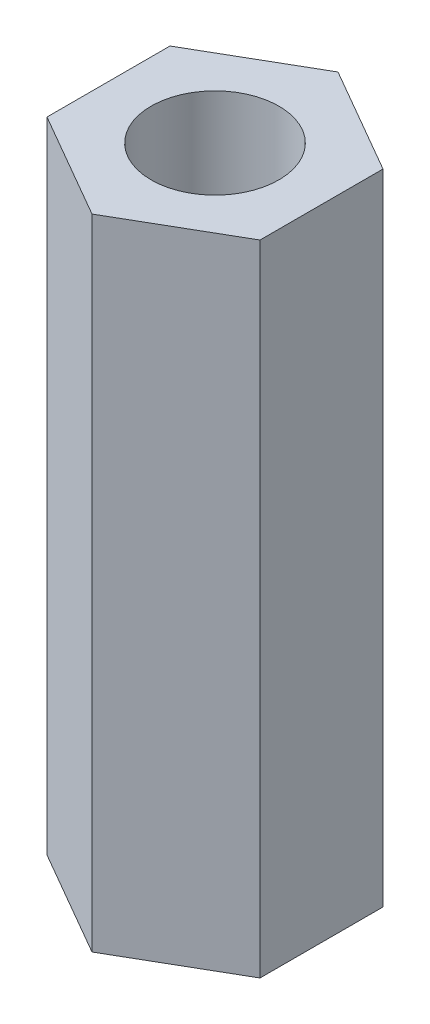
from build123d import *

# Parameters (mm, degrees)
ESQUISSE1_R        = 1.5
BOSS_EXTRU_1_DEPTH = 15


with BuildPart() as part:
    # Esquisse1 → Boss.-Extru.1 (new body)
    with BuildSketch(Plane(origin=(0, 0, 0), x_dir=(1, 0, 0), z_dir=(0, 1, 0))):
        Polygon((0, -2.886751346), (2.5, -1.443375673), (2.5, 1.443375673), (0, 2.886751346), (-2.5, 1.443375673), (-2.5, -1.443375673), align=None)
        with Locations(Location((0, 0, 0), (0, 0, 270))):
            Circle(ESQUISSE1_R, mode=Mode.SUBTRACT)
    extrude(amount=BOSS_EXTRU_1_DEPTH)


solid = part.part
